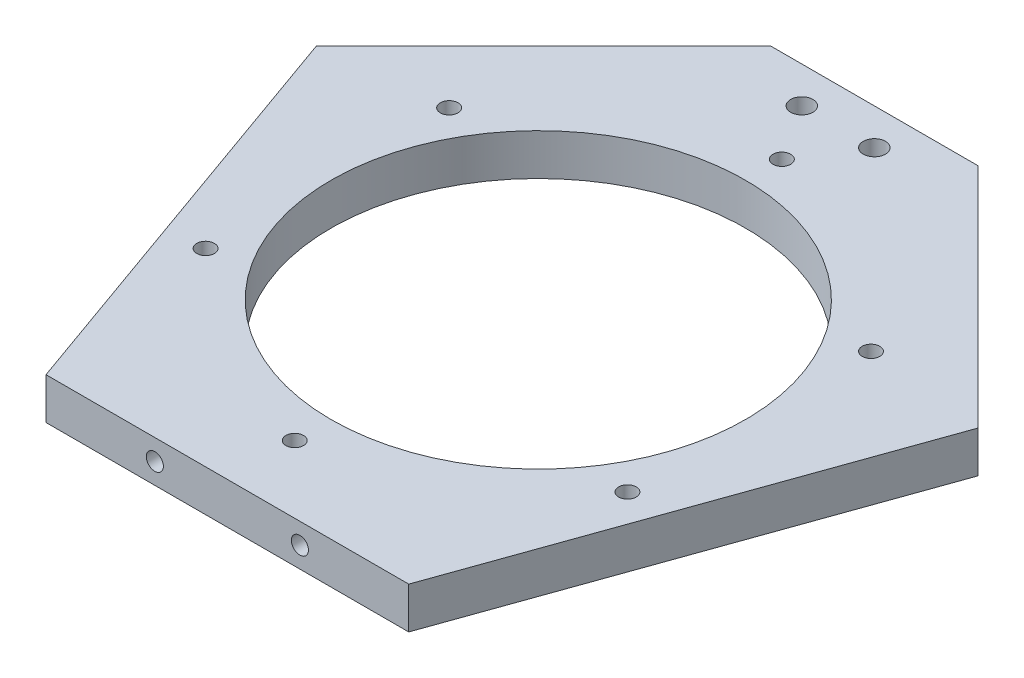
from build123d import *

# Parameters (mm, degrees)
SKETCH_2_R                  = 40
EXTRUDE_1_DEPTH             = 4
HOLE_WIZARD_M3_1_D          = 3.4
HOLE_WIZARD_M4_1_AT_2_COUNT = 2
HOLE_WIZARD_M4_1_AT_2_PITCH = 28
HOLE_WIZARD_M4_3_D          = 3.3
HOLE_WIZARD_M4_3_DEPTH      = 15
HOLE_WIZARD_M4_3_TIP        = 0.991420021
HOLE_WIZARD_M4_1_2_D        = 4.3


with BuildPart() as part:
    # 草图2 → 凸台-拉伸1 (new, symmetric)
    with BuildSketch(Plane(origin=(0, 0, 0), x_dir=(1, 0, 0), z_dir=(0, 1, 0))):
        Polygon((20, 64.852813742), (-20, 64.852813742), (-63.840620434, 21.012193309), (-35, -60), (35, -60), (63.840620434, 21.012193309), align=None)
        with Locations(Location((0, 0, 0), (0, 0, 270))):
            Circle(SKETCH_2_R, mode=Mode.SUBTRACT)
    extrude(amount=EXTRUDE_1_DEPTH, both=True)

    # M3 间隙孔1 (through all)
    with Locations(Plane(origin=(0, 4, 0), x_dir=(1, 0, 0), z_dir=(0, 1, 0))):
        with Locations((0, 47), (40.703193978, 23.5), (40.703193978, -23.5), (0, -47), (-40.703193978, -23.5), (-40.703193978, 23.5)):
            Hole(HOLE_WIZARD_M3_1_D / 2)

    # 草图7 → Hole Wizard M4 _1 (revolve, cut)
    with BuildSketch(Plane(origin=(32.526911935, 0, -52.325901808), x_dir=(-0.7071067811865476, 0, -0.7071067811865476), z_dir=(0, 1, 0))):
        Polygon((0, 0), (0, 12.991420021), (1.65, 12), (1.65, 0), align=None)
    hole_wizard_m4_1 = revolve(axis=Axis((37.017039995, 0, -56.816029868), (-0.7071067811865476, 0, 0.7071067811865476)), mode=Mode.SUBTRACT)

    # Hole Wizard M4 _1 at 2: Hole Wizard M4 _1 ×2
    with Locations(*[Vector(0.7071067811865476, 0, 0.7071067811865476) * (i * HOLE_WIZARD_M4_1_AT_2_PITCH) for i in range(1, HOLE_WIZARD_M4_1_AT_2_COUNT)]):
        add(hole_wizard_m4_1, mode=Mode.SUBTRACT)

    # 镜向1: Hole Wizard M4 _1 across plane
    add(hole_wizard_m4_1.mirror(Plane(origin=(0, 0, 0), x_dir=(0, 0, 1), z_dir=(1, 0, 0))), mode=Mode.SUBTRACT)

    # 镜向1 copy 1 sketch → 镜向1 copy 1 (revolve, cut)
    with BuildSketch(Plane(origin=(-52.325901808, 0, -32.526911935), x_dir=(0.7071067811865476, 0, -0.7071067811865476), z_dir=(0, 1, 0))):
        Polygon((0, 0), (0, -12.991420021), (1.65, -12), (1.65, 0), align=None)
    revolve(axis=Axis((-56.816029868, 0, -37.017039995), (-0.7071067811865476, 0, -0.7071067811865476)), mode=Mode.SUBTRACT)

    # M4 螺纹孔3
    with Locations(Plane.XY.offset(60)):
        with Locations((14, 0), (-14, 0)):
            Hole(HOLE_WIZARD_M4_3_D / 2, depth=HOLE_WIZARD_M4_3_DEPTH)
            with Locations((0, 0, -(HOLE_WIZARD_M4_3_DEPTH + HOLE_WIZARD_M4_3_TIP / 2))):  # 118° drill point
                Cone(0, HOLE_WIZARD_M4_3_D / 2, HOLE_WIZARD_M4_3_TIP, mode=Mode.SUBTRACT)

    # Hole Wizard M4 _1 2 (through all)
    with Locations(Plane(origin=(0, 4, 0), x_dir=(1, 0, 0), z_dir=(0, 1, 0))):
        with Locations((-7, 57.852813742), (7, 57.852813742)):
            Hole(HOLE_WIZARD_M4_1_2_D / 2)


solid = part.part
